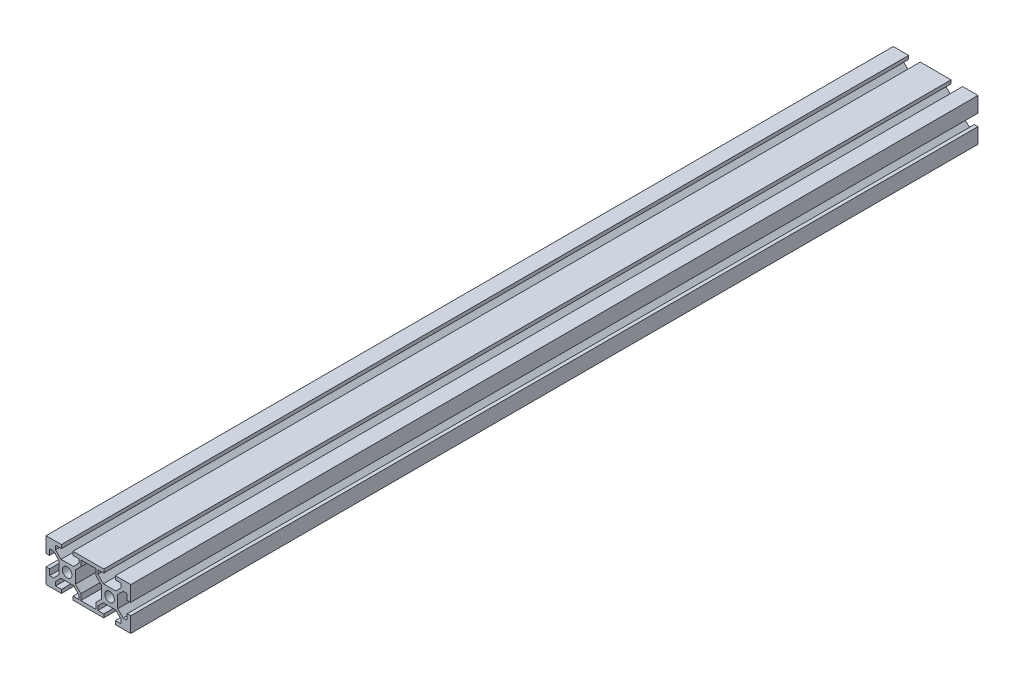
from build123d import *

# Parameters (mm, degrees)
SKETCH_1_R      = 3.4
EXTRUDE_1_DEPTH = 600


with BuildPart() as part:
    # 草图1 → 凸台-拉伸1 (new body)
    with BuildSketch(Plane.XY):
        Polygon((-4.1, 12.5), (-4.1, 15), (-8.25, 15), (-15, 15), (-15, 8.25), (-15, 4.1), (-12.5, 4.1), (-12.5, 8.25), (-9.664213562, 8.25), (-5.8, 4.385786438), (-5.8, -4.385786438), (-9.664213562, -8.25), (-12.5, -8.25), (-12.5, -4.1), (-15, -4.1), (-15, -8.25), (-15, -15), (-8.25, -15), (-4.1, -15), (-4.1, -12.5), (-8.25, -12.5), (-8.25, -9.664213562), (-4.385786438, -5.8), (4.385786438, -5.8), (8.25, -9.664213562), (8.25, -12.5), (4.1, -12.5), (4.1, -15), (8.25, -15), (15, -15), (21.75, -15), (25.9, -15), (25.9, -12.5), (21.75, -12.5), (21.75, -9.664213562), (25.614213562, -5.8), (34.385786438, -5.8), (38.25, -9.664213562), (38.25, -12.5), (34.1, -12.5), (34.1, -15), (38.25, -15), (45, -15), (45, -8.25), (45, -4.1), (42.5, -4.1), (42.5, -8.25), (39.664213562, -8.25), (35.8, -4.385786438), (35.8, 4.385786438), (39.664213562, 8.25), (42.5, 8.25), (42.5, 4.1), (45, 4.1), (45, 8.25), (45, 15), (38.25, 15), (34.1, 15), (34.1, 12.5), (38.25, 12.5), (38.25, 9.664213562), (34.385786438, 5.8), (25.614213562, 5.8), (21.75, 9.664213562), (21.75, 12.5), (25.9, 12.5), (25.9, 15), (21.75, 15), (15, 15), (8.25, 15), (4.1, 15), (4.1, 12.5), (8.25, 12.5), (8.25, 9.664213562), (4.385786438, 5.8), (-4.385786438, 5.8), (-8.25, 9.664213562), (-8.25, 12.5), align=None)
        Circle(SKETCH_1_R, mode=Mode.SUBTRACT)
        Polygon((9.664213562, -8.25), (5.8, -4.385786438), (5.8, 4.385786438), (9.664213562, 8.25), (9.664213562, 12.5), (20.335786438, 12.5), (20.335786438, 8.25), (24.2, 4.385786438), (24.2, -4.385786438), (20.335786438, -8.25), (20.335786438, -12.5), (9.664213562, -12.5), align=None, mode=Mode.SUBTRACT)
        with Locations((30, 0)):
            Circle(SKETCH_1_R, mode=Mode.SUBTRACT)
    extrude(amount=EXTRUDE_1_DEPTH)


solid = part.part
